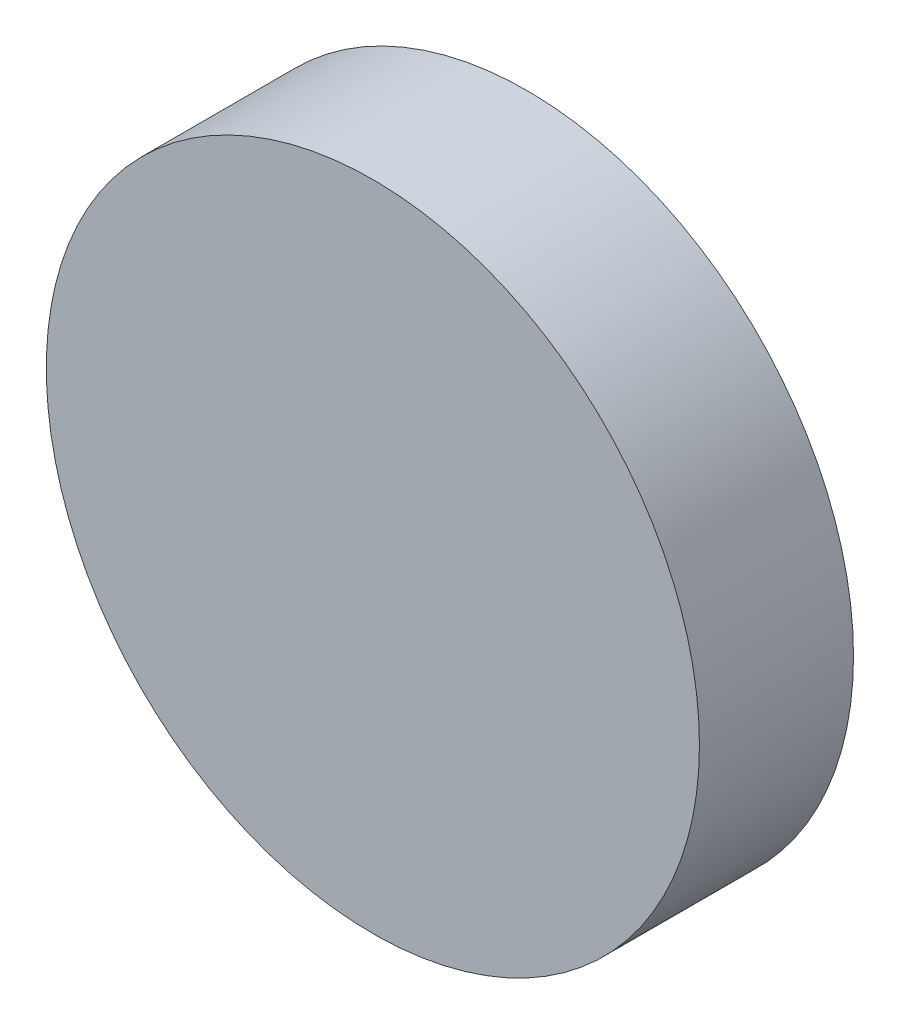
from build123d import *

# Parameters (mm, degrees)
SKETCH1_R           = 49.53
BOSS_EXTRUDE1_DEPTH = 23.368


with BuildPart() as part:
    # Sketch1 → Boss-Extrude1 (new body)
    with BuildSketch(Plane.XY):
        Circle(SKETCH1_R)
    extrude(amount=BOSS_EXTRUDE1_DEPTH)


solid = part.part
